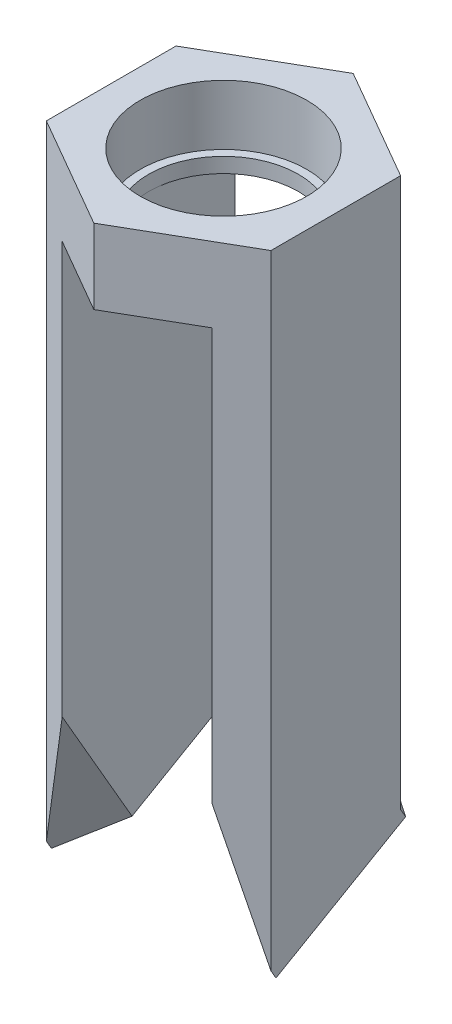
from build123d import *

# Parameters (mm, degrees)
SKETCH2_R           = 11.125
BOSS_EXTRUDE1_DEPTH = 8
SKETCH3_R           = 10
BOSS_EXTRUDE2_DEPTH = 2
BOSS_EXTRUDE3_DEPTH = 75
CUT_EXTRUDE1_DEPTH  = 85.433405711
BOSS_EXTRUDE4_DEPTH = 1.34
CUT_EXTRUDE4_DEPTH  = 81.030594237
SKETCH14_R          = 1.5
CUT_EXTRUDE6_DEPTH  = 10


with BuildPart() as part:
    # Sketch2 → Boss-Extrude1 (new body)
    with BuildSketch(Plane(origin=(0, 0, 0), x_dir=(1, 0, 0), z_dir=(0, 1, 0))):
        Polygon((0, 17.320508076), (-15, 8.660254038), (-15, -8.660254038), (0, -17.320508076), (15, -8.660254038), (15, 8.660254038), align=None)
        with Locations(Location((0, 0, 0), (0, 0, 270))):
            Circle(SKETCH2_R, mode=Mode.SUBTRACT)
    extrude(amount=BOSS_EXTRUDE1_DEPTH)

    # Sketch3 → Boss-Extrude2 (add)
    with BuildSketch(Plane.XZ):
        Polygon((0, 17.320508076), (-15, 8.660254038), (-15, -8.660254038), (0, -17.320508076), (15, -8.660254038), (15, 8.660254038), align=None)
        with Locations(Location((0, 0, 0), (0, 0, 270))):
            Circle(SKETCH3_R, mode=Mode.SUBTRACT)
    extrude(amount=BOSS_EXTRUDE2_DEPTH)

    # Sketch4 → Boss-Extrude3 (add)
    with BuildSketch(Plane.XZ.offset(2)):
        Polygon((-10, 11.547005384), (-15, 8.660254038), (-15, -8.660254038), (-10, -11.547005384), align=None)
        Polygon((10, -11.547005384), (15, -8.660254038), (15, 8.660254038), (10, 11.547005384), align=None)
    extrude(amount=BOSS_EXTRUDE3_DEPTH)

    # Sketch5 → Cut-Extrude1 (cut, through all)
    with BuildSketch(Plane.ZY.offset(15)):
        Polygon((11.547005384, -77), (-11.547005384, -63.666666667), (-11.547005384, -77), align=None)
    extrude(amount=-CUT_EXTRUDE1_DEPTH, mode=Mode.SUBTRACT)

    # Sketch6 → Boss-Extrude4 (add)
    with BuildSketch(Plane(origin=(0, -52.75, -30.4552267), x_dir=(1, 0, 0), z_dir=(-1.6525460586108427e-15, -0.8660254037844438, -0.4999999999999913))):
        Polygon((-10, 48.5), (-15, 45.166666667), (-15, 25.166666667), (-10, 21.833333333), align=None)
        Polygon((10, 48.5), (15, 45.166666667), (15, 25.166666667), (10, 21.833333333), align=None)
    extrude(amount=BOSS_EXTRUDE4_DEPTH)

    # Sketch9 → Cut-Extrude4 (cut, through all)
    with BuildSketch(Plane(origin=(0, -53.910474041, -31.1252267), x_dir=(1, 0, 0), z_dir=(0, -0.8660254037844435, -0.4999999999999916))):
        Polygon((-15, 45.166666667), (-10, 38.5), (-10, 48.5), align=None)
        Polygon((10, 48.5), (10, 38.5), (15, 45.166666667), align=None)
    extrude(amount=-CUT_EXTRUDE4_DEPTH, mode=Mode.SUBTRACT)

    # Sketch14 → Cut-Extrude6 (cut)
    with BuildSketch(Plane(origin=(0, -53.910474041, -31.1252267), x_dir=(1, 0, 0), z_dir=(-3.0355825822191097e-15, -0.8660254037844435, -0.4999999999999916))):
        with Locations(Location((-12.498602075, 34.732241333, 0), (0, 0, 270))):
            Circle(SKETCH14_R)
        with Locations(Location((-12.498602075, 27.580286063, 0), (0, 0, 270))):
            Circle(SKETCH14_R)
        with Locations(Location((12.498602075, 27.580286063, 0), (0, 0, 270))):
            Circle(SKETCH14_R)
        with Locations(Location((12.498602075, 37.148097384, 0), (0, 0, 270))):
            Circle(SKETCH14_R)
    extrude(amount=-CUT_EXTRUDE6_DEPTH, mode=Mode.SUBTRACT)


solid = part.part
